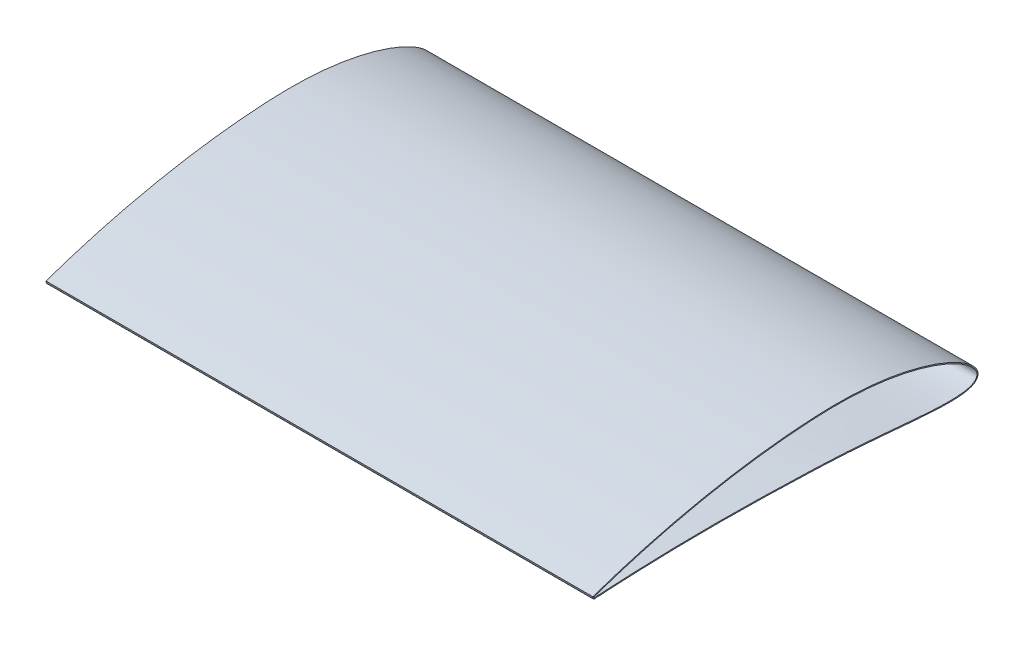
from build123d import *

# Parameters (mm, degrees)
BOSS_EXTRUDE1_DEPTH      = 254
BOSS_EXTRUDE1_DEPTH_BACK = 254


with BuildPart() as part:
    # Sketch1 → Boss-Extrude1 (new, two sides: drawn at the far end of the back side and taken through both)
    with BuildSketch(Plane(origin=(0, 0, 0), x_dir=(0, 0, -1), z_dir=(1, 0, 0)).offset(-BOSS_EXTRUDE1_DEPTH_BACK)):
        with BuildLine():
            Line((-355.781288272, -0.160012785), (-356.029432102, 1.07078061))
            add(Edge.make_bspline(
                [(-356.029432102, 1.07078061), (-348.806819492, 3.559113242), (-334.313734934, 8.398700499), (-305.022743767, 17.139774267), (-267.972198655, 26.504192186), (-230.439677726, 33.72165358), (-200.187559856, 38.113923979), (-177.399289958, 40.667649285), (-154.543117894, 42.448398739), (-131.60733866, 43.37552869), (-108.633179862, 42.796639269), (-89.570375869, 40.936854636), (-74.434041494, 38.568856386), (-63.162616753, 36.317570869), (-52.00066941, 33.556938235), (-40.983737466, 30.242390457), (-31.966303753, 26.959714369), (-24.89239851, 23.957660683), (-19.677996458, 21.488580995), (-14.578392512, 18.767371977), (-9.636506893, 15.733104208), (-5.720102944, 12.848500086), (-2.804124454, 10.210829411), (-0.809730437, 7.999278717), (0.953615268, 5.470618831), (1.826683491, 2.850521534), (1.82867387, 0.580355828), (1.343904458, -1.10871968), (0.433867293, -2.54458809), (-1.115234001, -4.13367896), (-3.409217256, -5.454350285), (-6.241275326, -6.446311694), (-9.116342157, -7.140725448), (-12.959585617, -7.769013993), (-17.782124811, -8.187529665), (-23.548306191, -8.361465088), (-29.302720313, -8.317752493), (-35.045462284, -8.12734485), (-40.776242291, -7.832364759), (-48.406701366, -7.338687341), (-57.926363598, -6.584361392), (-69.333283834, -5.582636058), (-80.733170317, -4.555678765), (-92.131319946, -3.551470703), (-107.33260805, -2.29570443), (-126.343691669, -0.963185188), (-145.383072415, -0.151084526), (-160.635246226, 0.366671857), (-175.885320809, 0.894354978), (-194.945600609, 1.440696269), (-217.824281848, 1.876904558), (-236.890374171, 2.025028249), (-252.143380178, 1.997669234), (-263.582914744, 1.904207979), (-275.021421222, 1.74043742), (-286.457612494, 1.495058549), (-295.987597162, 1.227414644), (-303.609666064, 0.981309317), (-309.32590133, 0.776871867), (-315.042784684, 0.551818103), (-320.757606454, 0.311301964), (-326.465376682, 0.05955421), (-331.229276996, -0.180109911), (-335.049877573, -0.383405167), (-337.910425921, -0.528754706), (-340.751794955, -0.648856977), (-343.103292828, -0.758153302), (-345.00321417, -0.882175475), (-346.442969676, -1.005010127), (-347.924581997, -1.141069568), (-349.393297779, -1.240433669), (-350.62562272, -1.247728107), (-351.512724547, -1.192636069), (-352.110927161, -1.17596663), (-352.608380679, -1.206884784), (-353.041582437, -1.277511434), (-353.327273482, -1.343205847), (-353.586061484, -1.417955465), (-353.833974729, -1.48926631), (-354.125296695, -1.555118315), (-354.489636695, -1.594127175), (-354.952837036, -1.523526628), (-355.373142592, -1.24668309), (-355.686815982, -0.816807398), (-355.758637622, -0.422606955), (-355.774783773, -0.260724663), (-355.781288272, -0.160012785)],
                knots=[-0.001196158, -0.001196158, -0.001196158, -0.001196158, 0.03008879, 0.061373738, 0.123943634, 0.18651353, 0.217798478, 0.249083426, 0.280368374, 0.311653322, 0.34293827, 0.374223218, 0.389865692, 0.405508166, 0.42115064, 0.436793114, 0.452435588, 0.460256825, 0.468078062, 0.475899299, 0.483720536, 0.491541773, 0.495452392, 0.49936301, 0.503273629, 0.507184247, 0.509139557, 0.511094866, 0.513050175, 0.515005484, 0.518916103, 0.522826721, 0.52673734, 0.530647958, 0.538469195, 0.546290432, 0.554111669, 0.561932906, 0.569754143, 0.57757538, 0.593217854, 0.608860328, 0.624502802, 0.640145276, 0.65578775, 0.687072698, 0.718357646, 0.73400012, 0.749642594, 0.780927542, 0.81221249, 0.843497438, 0.859139912, 0.874782386, 0.89042486, 0.906067334, 0.921709808, 0.929531045, 0.937352282, 0.945173519, 0.952994756, 0.960815993, 0.96863723, 0.972547849, 0.976458467, 0.980369086, 0.984279704, 0.986235014, 0.988190323, 0.990145632, 0.992100941, 0.994056251, 0.995033905, 0.99601156, 0.996989215, 0.997478042, 0.997966869, 0.998211283, 0.998455696, 0.99870011, 0.998944524, 0.999188937, 0.999311144, 0.999433351, 0.999677765, 0.999922178, 0.999922178, 0.999922178, 0.999922178], degree=3))
        make_face()
        with BuildLine():
            Line((-354.787327228, -0.030257196), (-354.876173011, 0.410417887))
            add(Edge.make_bspline(
                [(-354.876173011, 0.410417887), (-354.559877309, 0.519388), (-353.29965963, 0.95355787), (-350.47872665, 1.927095868), (-345.800950265, 3.497798274), (-336.024074692, 6.721551148), (-319.654473712, 11.798891927), (-300.598349456, 17.130600639), (-282.422876264, 21.724272526), (-261.175777938, 26.651569731), (-238.622276389, 31.145528798), (-208.774809213, 36.004755717), (-183.96165787, 39.090454058), (-158.902335219, 41.113212891), (-140.096691022, 42.111376668), (-121.516747473, 42.228858195), (-103.422167262, 41.321050632), (-86.188408528, 39.478676181), (-70.043450957, 36.810480574), (-55.199760436, 33.432905997), (-41.843390777, 29.510854383), (-30.130463623, 25.220125297), (-20.187014188, 20.73431935), (-12.107203154, 16.226289935), (-5.926897661, 11.855341958), (-1.679224073, 7.716499794), (0.765838065, 3.796757813), (0.987487677, -0.148325216), (-1.35108726, -3.308943186), (-5.450780885, -5.288085739), (-11.087315968, -6.587464624), (-18.34911979, -7.268527656), (-27.163826626, -7.404874951), (-37.447057223, -7.053797092), (-49.083078017, -6.301866785), (-61.95239395, -5.238034817), (-75.929862643, -3.983911698), (-96.406736552, -2.153555858), (-117.937239158, -0.458414508), (-140.484776897, 0.674535203), (-158.296467959, 1.286744043), (-176.48388462, 1.917893193), (-200.671973719, 2.586246563), (-224.541124114, 2.979106232), (-247.830237405, 3.028480659), (-264.337268621, 2.907447598), (-279.933149694, 2.656365926), (-294.437996632, 2.282890374), (-307.681856469, 1.852126627), (-319.513378006, 1.371074809), (-329.767358246, 0.912902227), (-338.388880463, 0.426846955), (-345.076973543, 0.191518705), (-350.227621538, -0.406394891), (-352.780150329, -0.035387827), (-354.744619464, -0.75811662), (-354.777220059, -0.20251155), (-354.787327228, -0.030257196)],
                knots=[0, 0, 0, 0, 0.001371577, 0.005464776, 0.012234802, 0.021601969, 0.04767125, 0.082496261, 0.102719149, 0.124527079, 0.171912573, 0.19697838, 0.248496767, 0.274385101, 0.300041178, 0.325689988, 0.350525088, 0.374279703, 0.396711254, 0.417576734, 0.436654006, 0.45374439, 0.468679994, 0.481329415, 0.491630702, 0.499615789, 0.505546281, 0.510184984, 0.514824194, 0.520701508, 0.52851604, 0.538465752, 0.550542609, 0.564643256, 0.580638139, 0.598344876, 0.617584458, 0.638174401, 0.682632113, 0.706120665, 0.730727383, 0.755700244, 0.780731769, 0.829932396, 0.853570292, 0.876213105, 0.897609987, 0.917519394, 0.935698347, 0.951942678, 0.966047159, 0.97783994, 0.987174002, 0.993931501, 0.998018399, 0.999385644, 1, 1, 1, 1], degree=3))
        make_face(mode=Mode.SUBTRACT)
    extrude(amount=BOSS_EXTRUDE1_DEPTH + BOSS_EXTRUDE1_DEPTH_BACK)


solid = part.part
